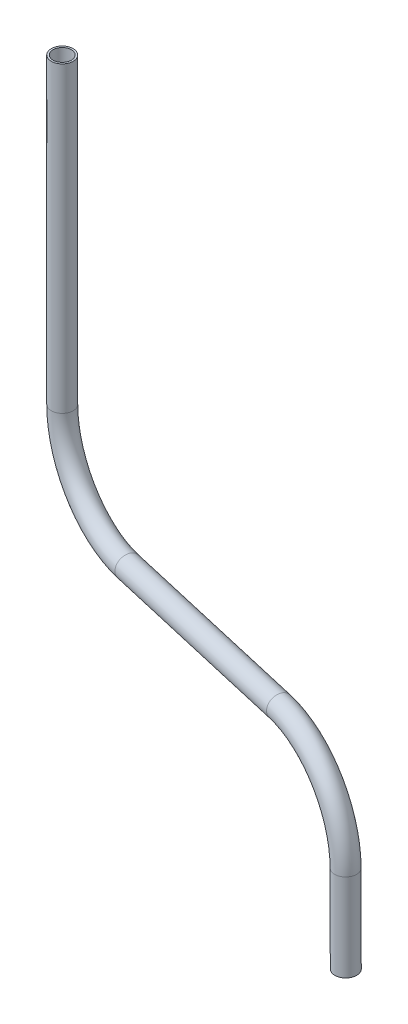
from build123d import *

# Parameters (mm, degrees)
SKETCH1_R                 = 6.35
SKETCH1_R_2               = 5.2832
PIPE_0_5_SCH_40_1_DEPTH   = 175.328598267
SKETCH1_ON_SEGMENT_2_R    = 6.35
SKETCH1_ON_SEGMENT_2_R_2  = 5.2832
PIPE_0_5_SCH_40_1_2_ANGLE = 90
SKETCH1_ON_SEGMENT_3_R    = 6.35
SKETCH1_ON_SEGMENT_3_R_2  = 5.2832
PIPE_0_5_SCH_40_1_3_DEPTH = 116.982148253
SKETCH1_ON_SEGMENT_4_R    = 6.35
SKETCH1_ON_SEGMENT_4_R_2  = 5.2832
PIPE_0_5_SCH_40_1_4_ANGLE = 90
SKETCH1_ON_SEGMENT_5_R    = 6.35
SKETCH1_ON_SEGMENT_5_R_2  = 5.2832
PIPE_0_5_SCH_40_1_5_DEPTH = 50.697047229


with BuildPart() as part:
    # Sketch1 → Pipe 0.5 SCH 40(1) (new body)
    with BuildSketch(Plane(origin=(-440.41650414, 719.319181201, 431.8), x_dir=(1, 0, 0), z_dir=(0, -1, 0))):
        Circle(SKETCH1_R)
        Circle(SKETCH1_R_2, mode=Mode.SUBTRACT)
    extrude(amount=PIPE_0_5_SCH_40_1_DEPTH)


with BuildPart() as body_2:
    # Sketch1 on segment 2 (carried to the start of arc 2) → Pipe 0.5 SCH 40_1 2 (revolve)
    with BuildSketch(Plane(origin=(-440.41650414, 543.990582935, 431.8), x_dir=(1, 0, 0), z_dir=(0, -1, 0))):
        Circle(SKETCH1_ON_SEGMENT_2_R)
        Circle(SKETCH1_ON_SEGMENT_2_R_2, mode=Mode.SUBTRACT)
    revolve(axis=Axis((-390.908254533, 543.990582935, 443.183023362), (-0.224075263, 0, 0.974571843)), revolution_arc=PIPE_0_5_SCH_40_1_2_ANGLE)


with BuildPart() as body_3:
    # Sketch1 on segment 3 (carried to segment 3) → Pipe 0.5 SCH 40_1 3 (new body)
    with BuildSketch(Plane(origin=(-390.908254533, 493.190582935, 443.183023362), x_dir=(0.050209724, 0.974571843, -0.218377442), z_dir=(0.974571843, 0, 0.224075263))):
        Circle(SKETCH1_ON_SEGMENT_3_R)
        Circle(SKETCH1_ON_SEGMENT_3_R_2, mode=Mode.SUBTRACT)
    extrude(amount=PIPE_0_5_SCH_40_1_3_DEPTH)


with BuildPart() as body_4:
    # Sketch1 on segment 4 (carried to the start of arc 4) → Pipe 0.5 SCH 40_1 4 (revolve)
    with BuildSketch(Plane(origin=(-276.900746752, 493.190582935, 469.395829002), x_dir=(0.050209724, 0.974571843, -0.218377442), z_dir=(0.974571843, 0, 0.224075263))):
        Circle(SKETCH1_ON_SEGMENT_4_R)
        Circle(SKETCH1_ON_SEGMENT_4_R_2, mode=Mode.SUBTRACT)
    revolve(axis=Axis((-276.882509946, 442.39064813, 469.316511553), (0.224074975, 0.001602106, -0.974570592)), revolution_arc=PIPE_0_5_SCH_40_1_4_ANGLE)


with BuildPart() as body_5:
    # Sketch1 on segment 5 (carried to segment 5) → Pipe 0.5 SCH 40_1 5 (new body)
    with BuildSketch(Plane(origin=(-227.374260339, 442.39064813, 480.699534915), x_dir=(0.999999936, 0.000358992, 2.8e-07), z_dir=(0.000358992, -0.999998717, -0.001561367))):
        Circle(SKETCH1_ON_SEGMENT_5_R)
        Circle(SKETCH1_ON_SEGMENT_5_R_2, mode=Mode.SUBTRACT)
    extrude(amount=PIPE_0_5_SCH_40_1_5_DEPTH)


with BuildPart() as part_1:
    add(part.part)

    # Pipe 0.5 SCH 40(1) as one body: union body 2, body 3, body 4, body 5
    add(body_2.part)
    add(body_3.part)
    add(body_4.part)
    add(body_5.part)


solid = part_1.part
